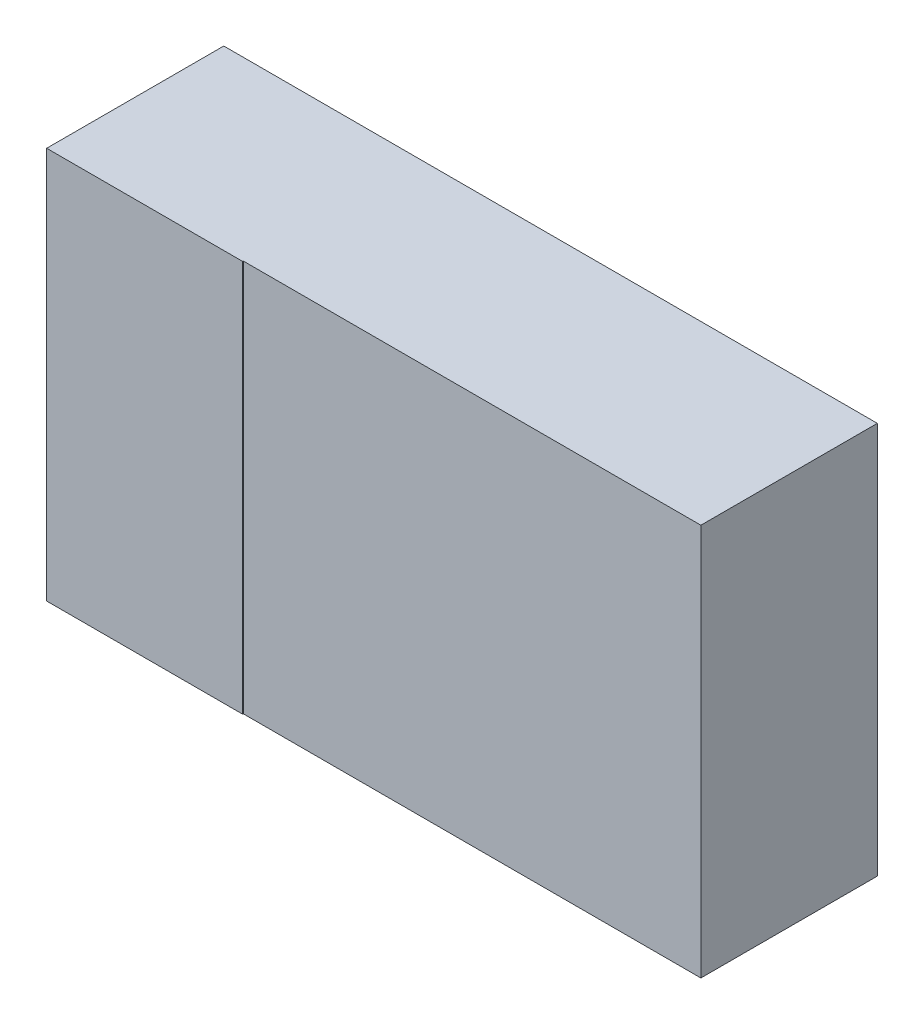
from build123d import *

# Parameters (mm, degrees)
ESQUISSE1_W  = 0.25
ESQUISSE1_H  = 0.5
PADS_DEPTH   = 0.03
PADS_2_DEPTH = 0.03
ESQUISSE2_W  = 1
ESQUISSE2_H  = 0.6
BODY_DEPTH   = 0.27
ESQUISSE3_W  = 0.3
ESQUISSE3_H  = 0.6
MARK_DEPTH   = 0.001


with BuildPart() as part:
    # Esquisse1 → pads (new body)
    with BuildSketch(Plane.XY):
        with Locations((-0.325, 0)):
            Rectangle(ESQUISSE1_W, ESQUISSE1_H)
    extrude(amount=PADS_DEPTH)



with BuildPart() as body_2:
    # Esquisse1 → pads 2 (new body)
    with BuildSketch(Plane.XY):
        with Locations((0.325, 0)):
            Rectangle(ESQUISSE1_W, ESQUISSE1_H)
    extrude(amount=PADS_2_DEPTH)


with BuildPart() as part_1:
    add(part.part)

    add(body_2.part)  # body merges body 2
    # Esquisse2 → body (add)
    with BuildSketch(Plane.XY.offset(0.03)):
        Rectangle(ESQUISSE2_W, ESQUISSE2_H)
    extrude(amount=BODY_DEPTH)

    # Esquisse3 → mark (add)
    with BuildSketch(Plane.XY.offset(0.3)):
        with Locations((-0.35, 0)):
            Rectangle(ESQUISSE3_W, ESQUISSE3_H)
    extrude(amount=MARK_DEPTH)


solid = part_1.part
